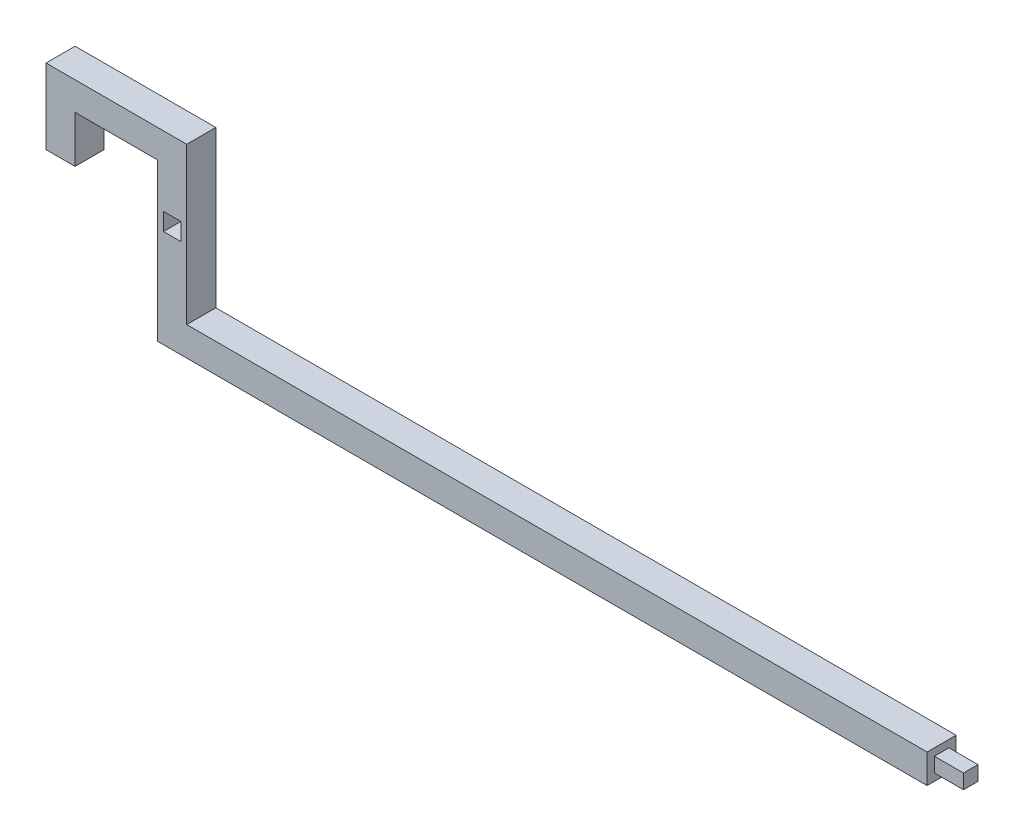
from build123d import *

# Parameters (mm, degrees)
BOSS_EXTRUDE1_DEPTH = 5
SKETCH2_W           = 2.5
SKETCH2_H           = 2.5
BOSS_EXTRUDE2_DEPTH = 5
SKETCH3_W           = 3
SKETCH3_H           = 3
CUT_EXTRUDE1_DEPTH  = 10


with BuildPart() as part:
    # Sketch1 → Boss-Extrude1 (new body)
    with BuildSketch(Plane.XY):
        Polygon((0, 6.7), (0, 8.05), (5.5, 8.05), (14.2, 8.05), (14.2, -18.95), (146.5, -18.95), (146.5, -13.95), (19.2, -13.95), (19.2, 12.9), (5.5, 12.9), (-5, 12.9), (-5, 0), (0, 0), align=None)
    extrude(amount=BOSS_EXTRUDE1_DEPTH)

    # Sketch2 → Boss-Extrude2 (add)
    with BuildSketch(Plane(origin=(146.5, 0, 0), x_dir=(0, 0, -1), z_dir=(1, 0, 0))):
        with Locations((-2.5, -16.45)):
            Rectangle(SKETCH2_W, SKETCH2_H)
    extrude(amount=BOSS_EXTRUDE2_DEPTH)

    # Sketch3 → Cut-Extrude1 (cut)
    with BuildSketch(Plane.XY.offset(5)):
        with Locations((16.7, -0.6)):
            Rectangle(SKETCH3_W, SKETCH3_H)
    extrude(amount=-CUT_EXTRUDE1_DEPTH, mode=Mode.SUBTRACT)


solid = part.part
